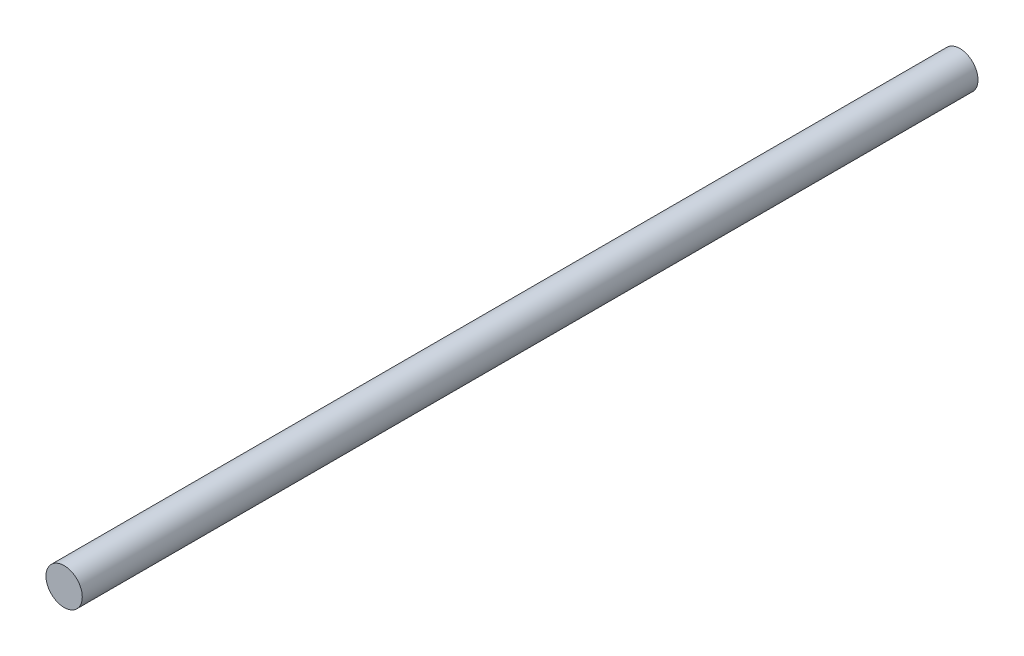
from build123d import *

# Parameters (mm, degrees)
SKETCH_1_R      = 1.5
EXTRUDE_1_DEPTH = 74


with BuildPart() as part:
    # 스케치1 → 돌출1 (new body)
    with BuildSketch(Plane.XY):
        Circle(SKETCH_1_R)
    extrude(amount=EXTRUDE_1_DEPTH)


solid = part.part
